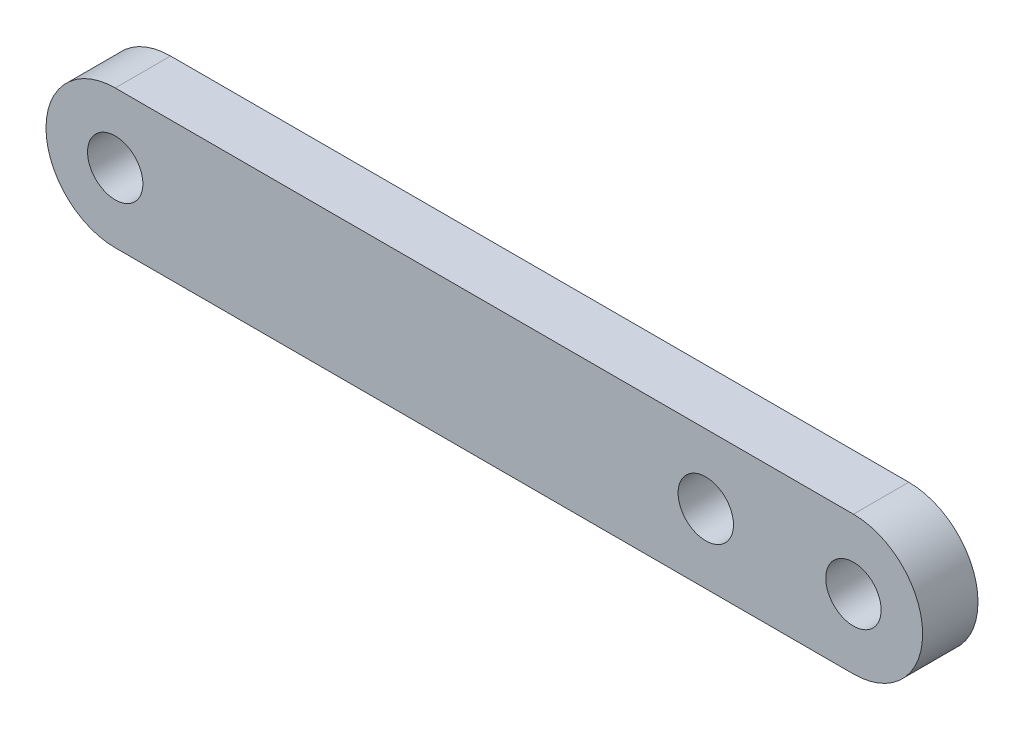
from build123d import *

# Parameters (mm, degrees)
SKETCH1_R           = 1.5
SKETCH1_R_2         = 3.75
BOSS_EXTRUDE1_DEPTH = 3


with BuildPart() as part:
    # Sketch1 → Boss-Extrude1 (new body)
    # profile 1 of 3: a face of its own
    with BuildSketch(Plane.XY):
        with BuildLine():
            Line((40, 3.75), (0, 3.75))
            ThreePointArc((0, 3.75), (2.651650429, 2.651650429), (3.75, 0))
            ThreePointArc((3.75, 0), (2.651650429, -2.651650429), (0, -3.75))
            Line((0, -3.75), (40, -3.75))
            ThreePointArc((40, -3.75), (36.25, 0), (40, 3.75))
        make_face()
        with Locations((32, 0)):
            Circle(SKETCH1_R, mode=Mode.SUBTRACT)
    # profile 2 of 3: a face of its own
    with BuildSketch(Plane.XY):
        Circle(SKETCH1_R_2)
        Circle(SKETCH1_R, mode=Mode.SUBTRACT)
    # profile 3 of 3: a face of its own
    with BuildSketch(Plane.XY):
        with Locations((40, 0)):
            Circle(SKETCH1_R_2)
        with Locations((40, 0)):
            Circle(SKETCH1_R, mode=Mode.SUBTRACT)
    extrude(amount=BOSS_EXTRUDE1_DEPTH)


solid = part.part
